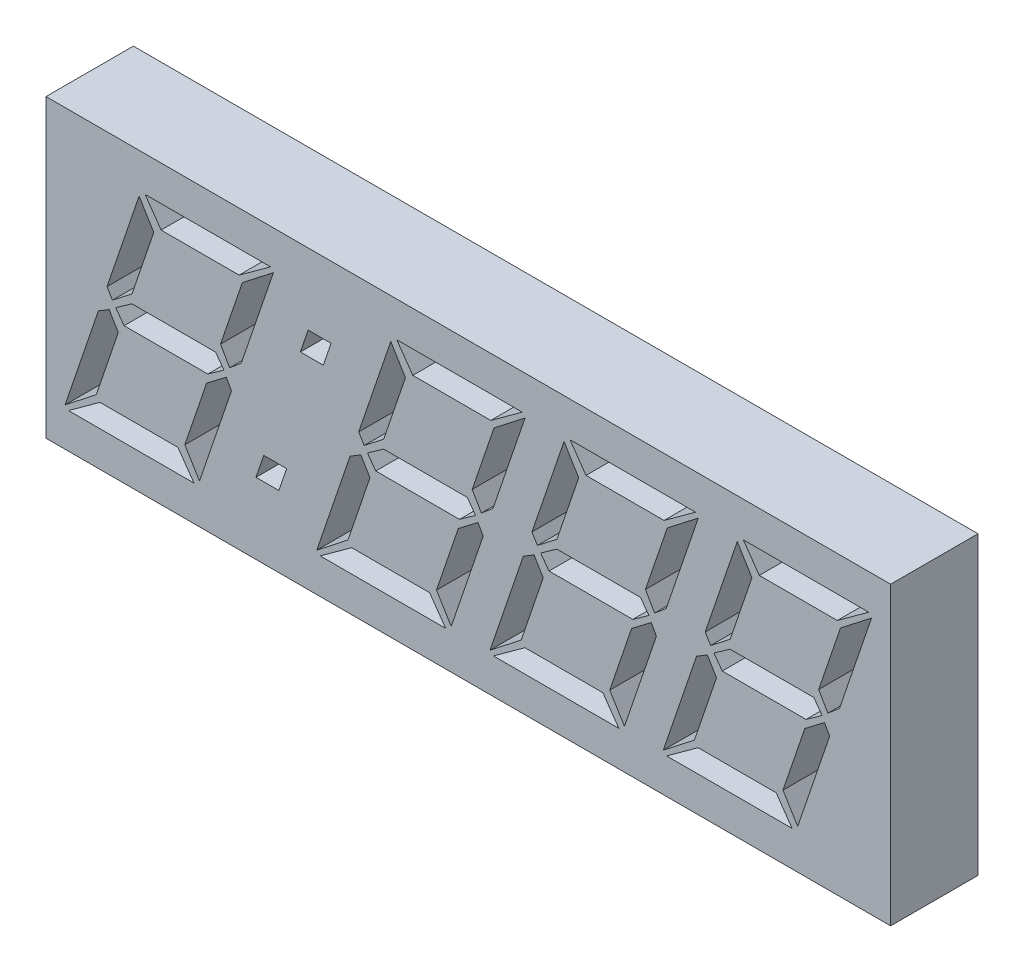
from build123d import *

# Parameters (mm, degrees)
SKETCH_1_W            = 500
SKETCH_1_H            = 220
EXTRUDE_1_DEPTH       = 50
CUT_EXTRUDE_1_DEPTH   = 65
SKETCH_3_W            = 24.993501938
SKETCH_3_H            = 24.754329671
EXTRUDE_2_DEPTH       = 50
SKETCH_4_W            = 557.488309353
SKETCH_4_H            = 263.064748201
SKETCH_4_W_2          = 497.488309353
SKETCH_4_H_2          = 203.064748201
CUT_EXTRUDE_1_2_DEPTH = 84
SCALE_1_SCALE         = 1.5
SKETCH_8_W            = 822.232464029
SKETCH_8_H            = 353.597122302
SKETCH_8_W_2          = 722.232464029
SKETCH_8_H_2          = 253.597122302
CUT_EXTRUDE_2_DEPTH   = 180
SKETCH_9_W            = 725
SKETCH_9_H            = 254
SKETCH_9_W_2          = 708.249145706
SKETCH_9_H_2          = 240.894932361
EXTRUDE_4_DEPTH       = 75


with BuildPart() as part:
    # Эскиз1 → Бобышка-Вытянуть1 (new body)
    with BuildSketch(Plane.XY):
        with Locations((315.178539616, -203.237931197)):
            Rectangle(SKETCH_1_W, SKETCH_1_H)
        Polygon((203.546220768, -131.339893042), (185.513397027, -144.433418222), (140.884350264, -144.433418222), (131.736418609, -131.339893042), align=None, mode=Mode.SUBTRACT)
        Polygon((159.677066091, -260.404641243), (87.867263933, -260.404641243), (105.900087674, -247.311116064), (150.529134437, -247.311116064), align=None, mode=Mode.SUBTRACT)
        Polygon((116.392443789, -207.416781531), (103.766544509, -244.593040524), (85.938307098, -258.534137646), (104.994062494, -202.419029733), (111.160879041, -198.678022538), align=None, mode=Mode.SUBTRACT)
        Polygon((109.933361055, -187.922626855), (128.287677602, -133.911835488), (136.67571717, -147.706799517), (124.225177602, -184.41543261), (113.060609257, -193.066511747), align=None, mode=Mode.SUBTRACT)
        Polygon((181.158630839, -203.997267143), (162.86276753, -257.832698797), (154.445501343, -244.066961387), (166.92526753, -207.299875056), (178.20674235, -198.678022538), align=None, mode=Mode.SUBTRACT)
        Polygon((174.874907818, -183.947806711), (187.354674005, -147.239173618), (205.124458178, -133.444209589), (186.770141631, -187.455000956), (180.106472566, -193.066511747), align=None, mode=Mode.SUBTRACT)
        Polygon((172.098379041, -189.325504553), (176.833091271, -195.872267143), (167.626706379, -202.419029733), (119.695051703, -202.419029733), (114.931112854, -195.872267143), (124.166724365, -189.325504553), align=None, mode=Mode.SUBTRACT)
        Polygon((188.173019329, -260.404641243), (192.615465372, -247.311116064), (205.708990552, -247.311116064), (201.266544509, -260.404641243), align=None, mode=Mode.SUBTRACT)
        Polygon((220.585339473, -165.00895779), (225.057012134, -151.91543261), (238.150537314, -151.91543261), (233.678864652, -165.00895779), align=None, mode=Mode.SUBTRACT)
        Polygon((347.574997746, -131.339893042), (329.542174005, -144.433418222), (284.913127242, -144.433418222), (275.765195588, -131.339893042), align=None, mode=Mode.SUBTRACT)
        Polygon((303.70584307, -260.404641243), (231.896040911, -260.404641243), (249.928864652, -247.311116064), (294.557911415, -247.311116064), align=None, mode=Mode.SUBTRACT)
        Polygon((260.421220768, -207.416781531), (247.795321487, -244.593040524), (229.967084077, -258.534137646), (249.022839473, -202.419029733), (255.189656019, -198.678022538), align=None, mode=Mode.SUBTRACT)
        Polygon((253.962138034, -187.922626855), (272.31645458, -133.911835488), (280.704494149, -147.706799517), (268.25395458, -184.41543261), (257.089386235, -193.066511747), align=None, mode=Mode.SUBTRACT)
        Polygon((325.187407818, -203.997267143), (306.891544509, -257.832698797), (298.474278321, -244.066961387), (310.954044509, -207.299875056), (322.235519329, -198.678022538), align=None, mode=Mode.SUBTRACT)
        Polygon((318.903684796, -183.947806711), (331.383450983, -147.239173618), (349.153235156, -133.444209589), (330.798918609, -187.455000956), (324.135249545, -193.066511747), align=None, mode=Mode.SUBTRACT)
        Polygon((316.127156019, -189.325504553), (320.86186825, -195.872267143), (311.655483357, -202.419029733), (263.723828681, -202.419029733), (258.959889832, -195.872267143), (268.195501343, -189.325504553), align=None, mode=Mode.SUBTRACT)
        Polygon((446.711688393, -131.339893042), (428.678864652, -144.433418222), (384.04981789, -144.433418222), (374.901886235, -131.339893042), align=None, mode=Mode.SUBTRACT)
        Polygon((402.842533717, -260.404641243), (331.032731559, -260.404641243), (349.0655553, -247.311116064), (393.694602063, -247.311116064), align=None, mode=Mode.SUBTRACT)
        Polygon((359.557911415, -207.416781531), (346.932012134, -244.593040524), (329.103774724, -258.534137646), (348.15953012, -202.419029733), (354.326346667, -198.678022538), align=None, mode=Mode.SUBTRACT)
        Polygon((353.098828681, -187.922626855), (371.453145228, -133.911835488), (379.841184796, -147.706799517), (367.390645228, -184.41543261), (356.226076883, -193.066511747), align=None, mode=Mode.SUBTRACT)
        Polygon((424.324098465, -203.997267143), (406.028235156, -257.832698797), (397.610968969, -244.066961387), (410.090735156, -207.299875056), (421.372209976, -198.678022538), align=None, mode=Mode.SUBTRACT)
        Polygon((418.040375444, -183.947806711), (430.520141631, -147.239173618), (448.289925804, -133.444209589), (429.935609257, -187.455000956), (423.271940192, -193.066511747), align=None, mode=Mode.SUBTRACT)
        Polygon((415.263846667, -189.325504553), (419.998558897, -195.872267143), (410.792174005, -202.419029733), (362.860519329, -202.419029733), (358.09658048, -195.872267143), (367.332191991, -189.325504553), align=None, mode=Mode.SUBTRACT)
        Polygon((545.848379041, -131.339893042), (527.8155553, -144.433418222), (483.186508537, -144.433418222), (474.038576883, -131.339893042), align=None, mode=Mode.SUBTRACT)
        Polygon((501.979224365, -260.404641243), (430.169422206, -260.404641243), (448.202245947, -247.311116064), (492.83129271, -247.311116064), align=None, mode=Mode.SUBTRACT)
        Polygon((458.694602063, -207.416781531), (446.068702782, -244.593040524), (428.240465372, -258.534137646), (447.296220768, -202.419029733), (453.463037314, -198.678022538), align=None, mode=Mode.SUBTRACT)
        Polygon((452.235519329, -187.922626855), (470.589835875, -133.911835488), (478.977875444, -147.706799517), (466.527335875, -184.41543261), (455.36276753, -193.066511747), align=None, mode=Mode.SUBTRACT)
        Polygon((523.460789113, -203.997267143), (505.164925804, -257.832698797), (496.747659616, -244.066961387), (509.227425804, -207.299875056), (520.508900624, -198.678022538), align=None, mode=Mode.SUBTRACT)
        Polygon((517.177066091, -183.947806711), (529.656832278, -147.239173618), (547.426616451, -133.444209589), (529.072299904, -187.455000956), (522.408630839, -193.066511747), align=None, mode=Mode.SUBTRACT)
        Polygon((514.400537314, -189.325504553), (519.135249545, -195.872267143), (509.928864652, -202.419029733), (461.997209976, -202.419029733), (457.233271127, -195.872267143), (466.468882638, -189.325504553), align=None, mode=Mode.SUBTRACT)
    extrude(amount=EXTRUDE_1_DEPTH)

    # Эскиз2 → Cut-Extrude 1 (cut)
    with BuildSketch(Plane.XY.offset(50)):
        Polygon((225.057012134, -151.91543261), (238.150537314, -151.91543261), (233.678864652, -165.00895779), (220.585339473, -165.00895779), align=None)
        Polygon((199.643902872, -226.731116064), (212.737428052, -226.731116064), (208.26575539, -239.824641243), (195.17223021, -239.824641243), align=None)
    extrude(amount=-CUT_EXTRUDE_1_DEPTH, mode=Mode.SUBTRACT)

    # Эскиз3 → Бобышка-Вытянуть2 (add)
    with BuildSketch(Plane.XY.offset(50)):
        with Locations((196.457377331, -256.289777907)):
            Rectangle(SKETCH_3_W, SKETCH_3_H)
    extrude(amount=-EXTRUDE_2_DEPTH)

    # Эскиз4 → Cut-Extrude 1 2 (cut)
    with BuildSketch(Plane.XY.offset(50)):
        with Locations((316.682461775, -195.872267142)):
            Rectangle(SKETCH_4_W, SKETCH_4_H)
        with Locations((316.682461775, -195.872267142)):
            Rectangle(SKETCH_4_W_2, SKETCH_4_H_2, mode=Mode.SUBTRACT)
    extrude(amount=-CUT_EXTRUDE_1_2_DEPTH, mode=Mode.SUBTRACT)


with BuildPart() as part_1:
    # Масштаб1: scaled about (314.289349403, -195.861916492, 25)
    add(part.part.scale(SCALE_1_SCALE).moved(Location((-157.144674702, 97.930958246, -12.5))))

    # Эскиз8 → Вырез-Вытянуть-Тонкостенный2 (cut)
    with BuildSketch(Plane.XY.offset(62.5)):
        with Locations((317.879017961, -195.877442468)):
            Rectangle(SKETCH_8_W, SKETCH_8_H)
        with Locations((317.879017961, -195.877442468)):
            Rectangle(SKETCH_8_W_2, SKETCH_8_H_2, mode=Mode.SUBTRACT)
    extrude(amount=-CUT_EXTRUDE_2_DEPTH, mode=Mode.SUBTRACT)

    # Эскиз9 → Бобышка-Вытянуть4 (add)
    with BuildSketch(Plane.XY.offset(62.5)):
        with Locations((317.877785946, -195.878881317)):
            Rectangle(SKETCH_9_W, SKETCH_9_H)
        with Locations((317.250065853, -196.40613993)):
            Rectangle(SKETCH_9_W_2, SKETCH_9_H_2, mode=Mode.SUBTRACT)
    extrude(amount=-EXTRUDE_4_DEPTH)


solid = part_1.part
